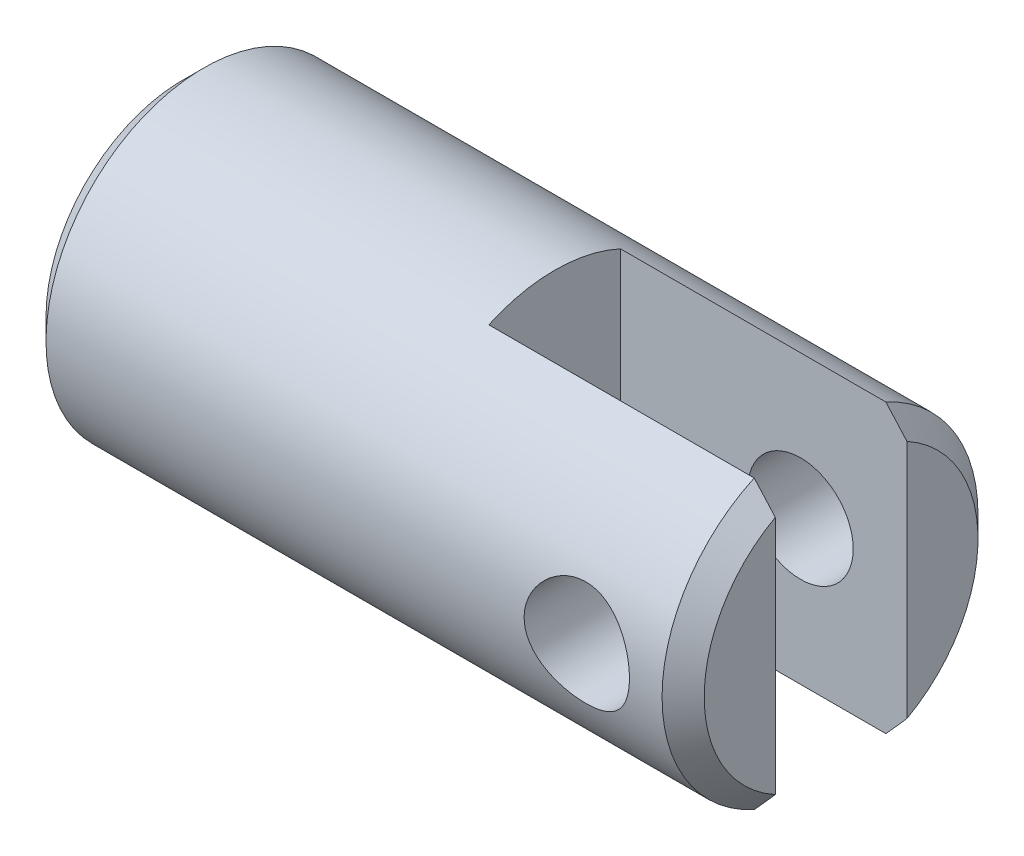
from build123d import *

# Parameters (mm, degrees)
SKETCH1_R               = 9.525
BASE_EXTRUDE_DEPTH      = 39.6875
CUT_EXTRUDE1_START      = -17.272
CUT_EXTRUDE1_DEPTH      = 17.272
CUT_EXTRUDE2_DEPTH      = 42.911202634
CUT_EXTRUDE2_DEPTH_BACK = 42.911202634
SKETCH3_R               = 3.175
CHAMFER1_SIZE           = 1.27
SKETCH4_R               = 3.175
CUT_EXTRUDE3_DEPTH      = 19.05


with BuildPart() as part:
    # Sketch1 → Base-Extrude (new body)
    with BuildSketch(Plane(origin=(0, 0, 0), x_dir=(0, 0, -1), z_dir=(1, 0, 0))):
        with Locations(Location((0, 0, 0), (0, 0, 180))):
            Circle(SKETCH1_R)
    extrude(amount=BASE_EXTRUDE_DEPTH)

    # Sketch2 → Cut-Extrude1 (cut)
    with BuildSketch(Plane(origin=(39.6875, 0, 0), x_dir=(0, 0, -1), z_dir=(1, 0, 0)).offset(CUT_EXTRUDE1_START)):
        with BuildLine():
            Line((-3.96875, 8.658790241), (-3.96875, -8.658790241))
            ThreePointArc((-3.96875, -8.658790241), (0, -9.525), (3.96875, -8.658790241))
            Line((3.96875, -8.658790241), (3.96875, 8.658790241))
            ThreePointArc((3.96875, 8.658790241), (0, 9.525), (-3.96875, 8.658790241))
        make_face()
    extrude(amount=CUT_EXTRUDE1_DEPTH, mode=Mode.SUBTRACT)

    # Sketch3 → Cut-Extrude2 (cut, two sides: drawn at the far end of the back side and taken through both)
    with BuildSketch(Plane.XY.offset(-CUT_EXTRUDE2_DEPTH_BACK)):
        with Locations((33.274, 0)):
            Circle(SKETCH3_R)
    extrude(amount=CUT_EXTRUDE2_DEPTH + CUT_EXTRUDE2_DEPTH_BACK, mode=Mode.SUBTRACT)

    # Chamfer1
    chamfer1_edges = [part.edges().sort_by_distance(p)[0] for p in [
        (0, 0, -9.525),
        (39.6875, -5.144087929, 8.016482045),
        (39.6875, 0, -9.525),
    ]]
    chamfer(chamfer1_edges, length=CHAMFER1_SIZE)

    # Sketch4 → Cut-Extrude3 (cut)
    with BuildSketch(Plane.ZY):
        Circle(SKETCH4_R)
    extrude(amount=-CUT_EXTRUDE3_DEPTH, mode=Mode.SUBTRACT)


solid = part.part
